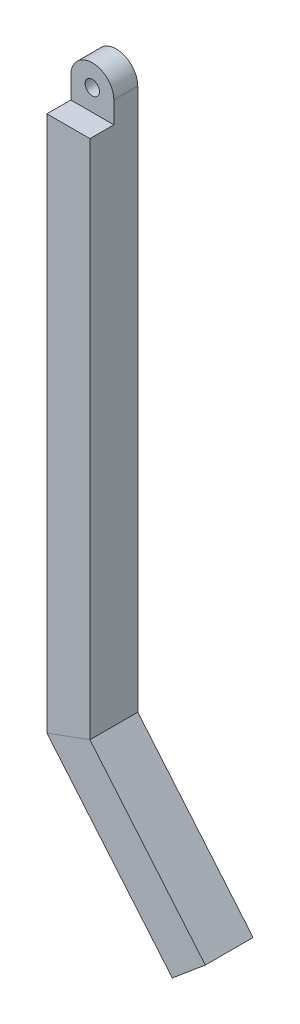
from build123d import *

# Parameters (mm, degrees)
SKETCH_4_W          = 9
SKETCH_4_H          = 10
EXTRUDE_2_DEPTH     = 10
CUT_EXTRUDE_1_DEPTH = 10
SKETCH_4_2_W        = 9
SKETCH_4_2_H        = 10
CUT_EXTRUDE_START   = 10
CUT_EXTRUDE_2_DEPTH = 10
SKETCH_8_R          = 1.5
CUT_EXTRUDE_3_DEPTH = 10


with BuildPart() as part:
    # 草图4 → 凸台-拉伸2 (new body)
    with BuildSketch(Plane(origin=(0, 0, 0), x_dir=(1, 0, 0), z_dir=(0, 1, 0))):
        with Locations((-19.8, -3.957142857)):
            Rectangle(SKETCH_4_W, SKETCH_4_H)
    extrude(amount=EXTRUDE_2_DEPTH)

    # 草图6 → 切除-拉伸1 (cut)
    with BuildSketch(Plane.XY.offset(8.957142857)):
        with BuildLine():
            Line((-24.3, 10), (-24.3, 5))
            ThreePointArc((-24.3, 5), (-19.8, 9.5), (-15.3, 5))
            Line((-15.3, 5), (-15.3, 10))
            Line((-15.3, 10), (-24.3, 10))
        make_face()
    extrude(amount=-CUT_EXTRUDE_1_DEPTH, mode=Mode.SUBTRACT)

    # 扫描2: sweep along a path in 草图5
    with BuildLine(Plane.XY.offset(3.957142857)) as sweep_2_path:
        Line((-19.8, 0), (-19.8, -110))
        Line((-19.8, -110), (5.372988935, -140))
    # 草图4<2> → 扫描2 (sweep)
    with BuildSketch(Plane(origin=(0, 0, 0), x_dir=(1, 0, 0), z_dir=(0, 1, 0))):
        with Locations((-19.8, -3.957142857)):
            Rectangle(SKETCH_4_2_W, SKETCH_4_2_H)
    sweep(path=sweep_2_path.line, transition=Transition.RIGHT)

    # 草图7 → 切除-拉伸2 (cut)
    with BuildSketch(Plane.XY.offset(3.957142857).offset(CUT_EXTRUDE_START)):
        with BuildLine():
            Line((-24.3, 5), (-24.3, 0.5))
            Line((-24.3, 0.5), (-15.3, 0.5))
            Line((-15.3, 0.5), (-15.3, 5))
            ThreePointArc((-15.3, 5), (-19.8, 9.5), (-24.3, 5))
        make_face()
    extrude(amount=-CUT_EXTRUDE_2_DEPTH, mode=Mode.SUBTRACT)

    # 草图8 → 切除-拉伸3 (cut)
    with BuildSketch(Plane.XY.offset(3.957142857)):
        with Locations((-19.8, 5)):
            Circle(SKETCH_8_R)
    extrude(amount=-CUT_EXTRUDE_3_DEPTH, mode=Mode.SUBTRACT)


solid = part.part
